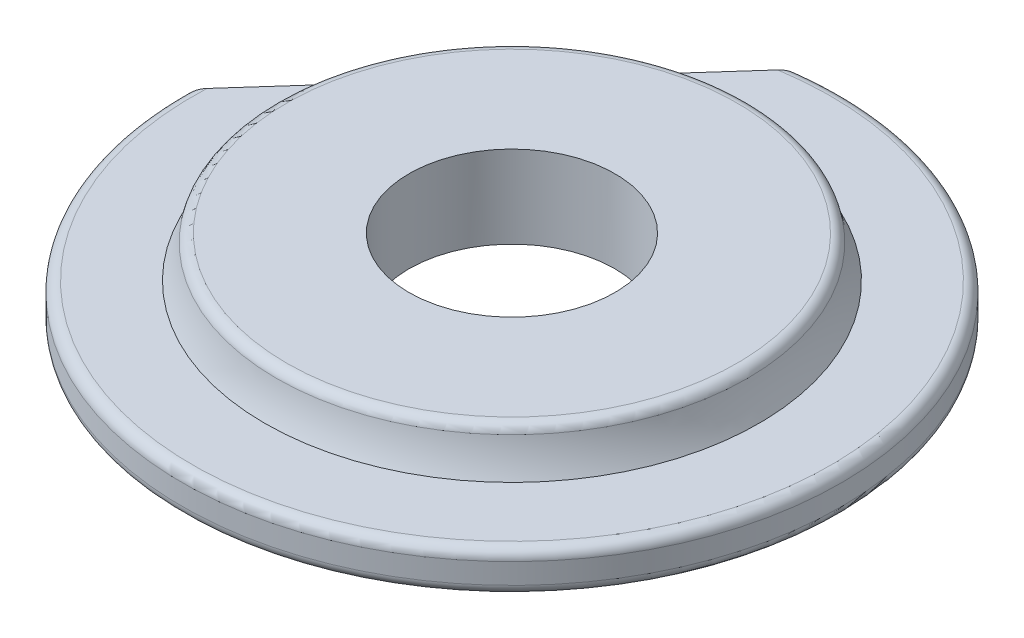
from build123d import *

# Parameters (mm, degrees)
CONG_1_R                = 2.5
ENL_V_MAT_EXTRU_1_REACH = 181.165
ENL_V_MAT_EXTRU_2_REACH = 182
ESQUISSE4_R             = 25
ECHELLE1_SCALE          = 0.25


with BuildPart() as part:
    # Esquisse1 → Révolution1 (revolve)
    with BuildSketch(Plane.XY, mode=Mode.PRIVATE) as r_volution1_sk:
        with BuildLine():
            Line((0, 0), (80, 0))
            Line((80, 0), (80, 20))
            Line((80, 20), (23.203122076, 20))
            ThreePointArc((23.203122076, 20), (22.035240729, 14.861087101), (20, 10))
            Line((20, 10), (0, 10))
            Line((0, 10), (0, 0))
        make_face()
    revolve(r_volution1_sk.sketch.rotate(Axis((80, 20, 0), (0, -1, 0)), 270), axis=Axis((80, 20, 0), (0, -1, 0)))

    # Congé1
    cong_1_edges = [part.edges().sort_by_distance(p)[0] for p in [
        (80, 10, -80),
        (80, 20, -56.796877924),
        (80, 0, -80),
    ]]
    fillet(cong_1_edges, radius=CONG_1_R)

    # Esquisse3 → Enlèv. mat.-Extru.1 (cut, up to next)
    with BuildSketch(Plane(origin=(0, 10, 0), x_dir=(1, 0, 0), z_dir=(0, 1, 0)), mode=Mode.PRIVATE) as enl_v_mat_extru_1_sk1:
        with BuildLine():
            Line((0.001700291, 0.521578063), (70.517699728, 79.436049635))
            ThreePointArc((70.517699728, 79.436049635), (20.346266679, 53.305085132), (0.001700291, 0.521578063))
        make_face()
    enl_v_mat_extru_1_tool1 = extrude(enl_v_mat_extru_1_sk1.sketch, amount=-ENL_V_MAT_EXTRU_1_REACH, mode=Mode.PRIVATE) & part.part
    add(enl_v_mat_extru_1_tool1.solids().sort_by_distance((29.225405, 10, -45.370909))[0], mode=Mode.SUBTRACT)

    # Esquisse4 → Enlèv. mat.-Extru.2 (cut, up to next)
    with BuildSketch(Plane(origin=(0, 20, 0), x_dir=(1, 0, 0), z_dir=(0, 1, 0)), mode=Mode.PRIVATE) as enl_v_mat_extru_2_sk1:
        with Locations(Location((80, 0, 0), (0, 0, 270))):
            Circle(ESQUISSE4_R)
    enl_v_mat_extru_2_tool1 = extrude(enl_v_mat_extru_2_sk1.sketch, amount=-ENL_V_MAT_EXTRU_2_REACH, mode=Mode.PRIVATE) & part.part
    add(enl_v_mat_extru_2_tool1.solids().sort_by_distance((80, 20, 0))[0], mode=Mode.SUBTRACT)


with BuildPart() as part_1:
    # Echelle1: scaled about (82.857724796, 8.371696778, 2.553591737)
    add(part.part.scale(ECHELLE1_SCALE).moved(Location((62.143293597, 6.278772584, 1.915193803))))


solid = part_1.part
